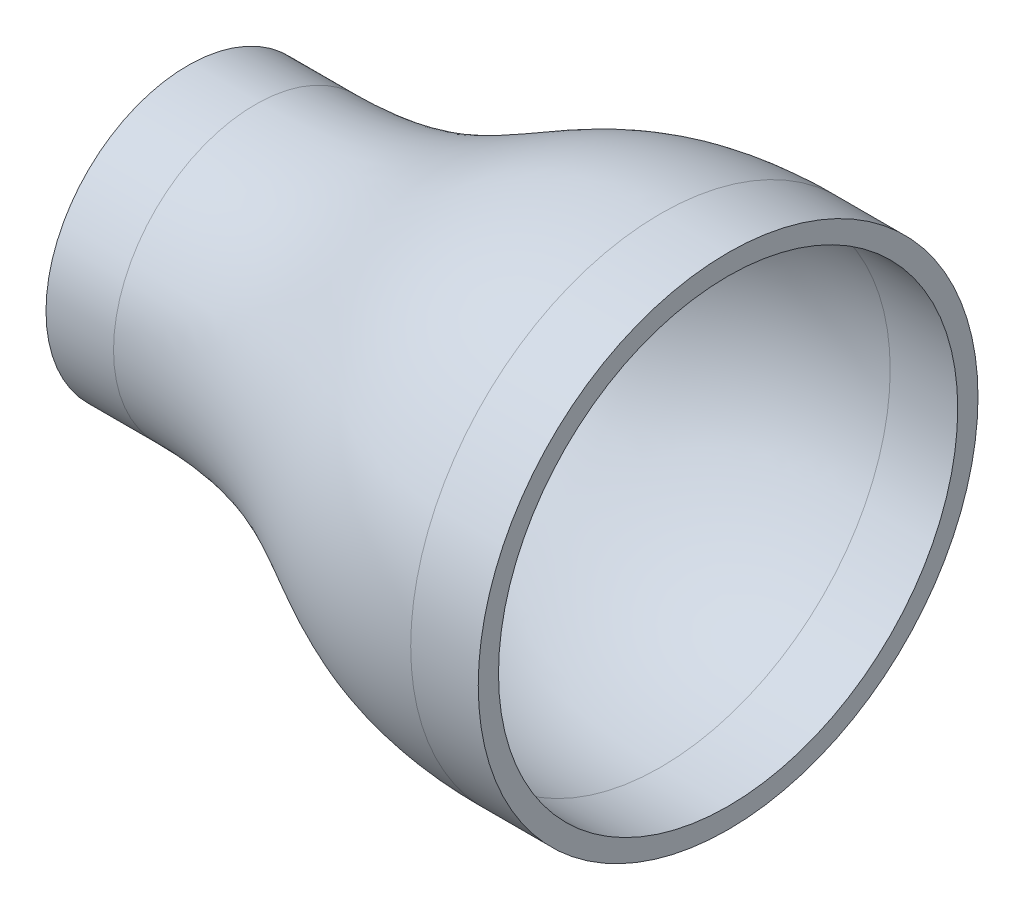
from build123d import *


with BuildPart() as part:
    # Sketch1 → Revolve1 (revolve)
    with BuildSketch(Plane(origin=(0, 0, 0), x_dir=(1, 0, 0), z_dir=(0, 1, 0)), mode=Mode.PRIVATE) as revolve1_sk:
        with BuildLine():
            Line((0, 9), (-5, 9))
            Line((-5, 9), (-5, 10.5))
            Line((-5, 10.5), (0, 10.5))
            add(Edge.make_bspline(
                [(0, 10.5), (15, 10.5), (15, 18.5), (30, 18.5)],
                knots=[0, 0, 0, 0, 1, 1, 1, 1], degree=3))
            Line((30, 18.5), (35, 18.5))
            Line((35, 18.5), (35, 17))
            Line((35, 17), (30, 17))
            add(Edge.make_bspline(
                [(0, 9), (15, 9), (15, 17), (30, 17)],
                knots=[0, 0, 0, 0, 1, 1, 1, 1], degree=3))
        make_face()
    revolve(revolve1_sk.sketch.rotate(Axis((0, 0, 0), (1, 0, 0)), 180), axis=Axis((0, 0, 0), (1, 0, 0)))


solid = part.part
